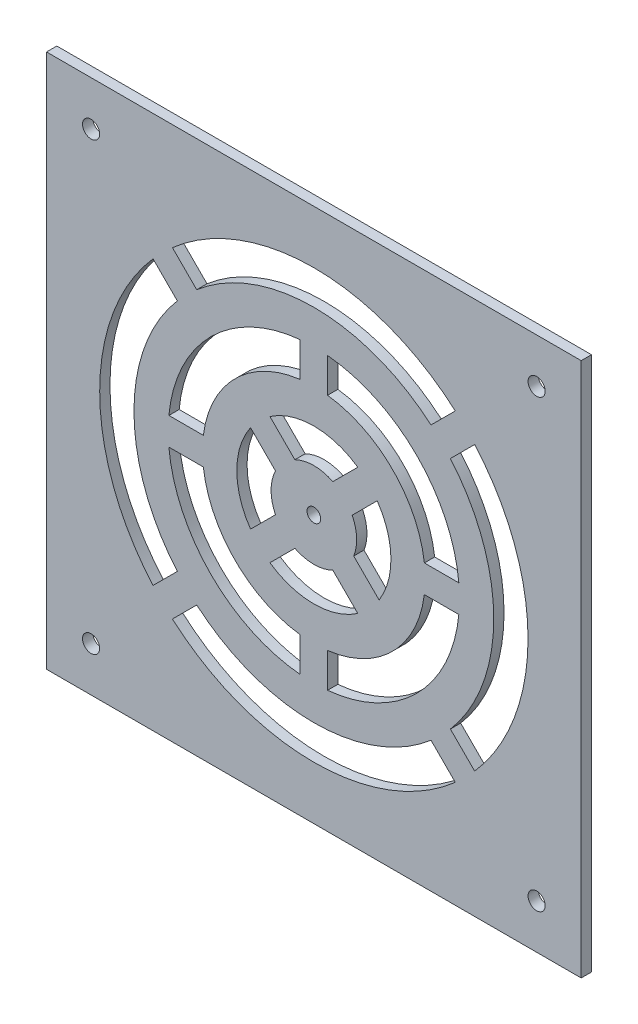
from build123d import *

# Parameters (mm, degrees)
SKETCH1_W           = 150
SKETCH1_H           = 150
BOSS_EXTRUDE1_DEPTH = 3
CUT_EXTRUDE1_DEPTH  = 264.0332057
SKETCH4_R           = 2.5
CUT_EXTRUDE2_DEPTH  = 3
SKETCH5_W           = 156
SKETCH5_H           = 156
SKETCH5_W_2         = 150
SKETCH5_H_2         = 150
BOSS_EXTRUDE2_DEPTH = 3
SKETCH6_R           = 2
CUT_EXTRUDE3_DEPTH  = 10


with BuildPart() as part:
    # Sketch1 → Boss-Extrude1 (new body)
    with BuildSketch(Plane.XY):
        with Locations((146.896551724, 66.206896552)):
            Rectangle(SKETCH1_W, SKETCH1_H)
    extrude(amount=BOSS_EXTRUDE1_DEPTH)

    # Sketch2 → Cut-Extrude1 (cut, through all)
    with BuildSketch(Plane.XY.offset(3)):
        with BuildLine():
            ThreePointArc((188.163122783, 113.13032186), (146.896551724, 128.694797217), (105.629980666, 113.13032186))
            Line((105.629980666, 113.13032186), (112.718359737, 106.041942789))
            ThreePointArc((112.718359737, 106.041942789), (146.896551724, 118.694797217), (181.074743712, 106.041942789))
            Line((181.074743712, 106.041942789), (188.163122783, 113.13032186))
        make_face()
        with BuildLine():
            Line((107.061505487, 100.385088539), (99.973126416, 107.47346761))
            ThreePointArc((99.973126416, 107.47346761), (84.408651059, 66.206896552), (99.973126416, 24.940325493))
            Line((99.973126416, 24.940325493), (107.061505487, 32.028704564))
            ThreePointArc((107.061505487, 32.028704564), (94.408651059, 66.206896552), (107.061505487, 100.385088539))
        make_face()
        with BuildLine():
            ThreePointArc((209.384452389, 66.206896552), (205.363995952, 88.259009716), (193.819977032, 107.47346761))
            Line((193.819977032, 107.47346761), (186.731597961, 100.385088539))
            ThreePointArc((186.731597961, 100.385088539), (196.119705149, 84.429434333), (199.384452389, 66.206896552))
            ThreePointArc((199.384452389, 66.206896552), (196.119705149, 47.984358771), (186.731597961, 32.028704564))
            Line((186.731597961, 32.028704564), (193.819977032, 24.940325493))
            ThreePointArc((193.819977032, 24.940325493), (205.363995952, 44.154783387), (209.384452389, 66.206896552))
        make_face()
        with BuildLine():
            Line((112.718359737, 26.371850315), (105.629980666, 19.283471244))
            ThreePointArc((105.629980666, 19.283471244), (146.896551724, 3.718995886), (188.163122783, 19.283471244))
            Line((188.163122783, 19.283471244), (181.074743712, 26.371850315))
            ThreePointArc((181.074743712, 26.371850315), (146.896551724, 13.718995886), (112.718359737, 26.371850315))
        make_face()
        with BuildLine():
            ThreePointArc((150.896551724, 23.907703853), (176.940034403, 36.163413873), (189.195744423, 62.206896552))
            Line((189.195744423, 62.206896552), (179.137266506, 62.206896552))
            ThreePointArc((179.137266506, 62.206896552), (169.868966591, 43.234481685), (150.896551724, 33.96618177))
            Line((150.896551724, 33.96618177), (150.896551724, 23.907703853))
        make_face()
        with BuildLine():
            Line((114.655836942, 62.206896552), (104.597359026, 62.206896552))
            ThreePointArc((104.597359026, 62.206896552), (116.853069045, 36.163413873), (142.896551724, 23.907703853))
            Line((142.896551724, 23.907703853), (142.896551724, 33.96618177))
            ThreePointArc((142.896551724, 33.96618177), (123.924136857, 43.234481685), (114.655836942, 62.206896552))
        make_face()
        with BuildLine():
            Line((142.896551724, 98.447611333), (142.896551724, 108.50608925))
            ThreePointArc((142.896551724, 108.50608925), (116.853069045, 96.250379231), (104.597359026, 70.206896552))
            Line((104.597359026, 70.206896552), (114.655836942, 70.206896552))
            ThreePointArc((114.655836942, 70.206896552), (123.924136857, 89.179311419), (142.896551724, 98.447611333))
        make_face()
        with BuildLine():
            ThreePointArc((189.195744423, 70.206896552), (176.940034403, 96.250379231), (150.896551724, 108.50608925))
            Line((150.896551724, 108.50608925), (150.896551724, 98.447611333))
            ThreePointArc((150.896551724, 98.447611333), (169.868966591, 89.179311419), (179.137266506, 70.206896552))
            Line((179.137266506, 70.206896552), (189.195744423, 70.206896552))
        make_face()
        with BuildLine():
            Line((165.372753073, 79.026243651), (158.090015102, 71.74350568))
            ThreePointArc((158.090015102, 71.74350568), (159.056537781, 69.049853135), (159.384452389, 66.206896552))
            ThreePointArc((159.384452389, 66.206896552), (159.166880972, 63.885973637), (158.521748029, 61.645923641))
            Line((158.521748029, 61.645923641), (165.932760465, 54.234911206))
            ThreePointArc((165.932760465, 54.234911206), (168.504305512, 59.977076926), (169.384452389, 66.206896552))
            ThreePointArc((169.384452389, 66.206896552), (168.358106385, 72.923096956), (165.372753073, 79.026243651))
        make_face()
        with BuildLine():
            Line((134.077204625, 84.6830979), (141.359942596, 77.400359929))
            ThreePointArc((141.359942596, 77.400359929), (146.896551724, 78.694797217), (152.433160852, 77.400359929))
            Line((152.433160852, 77.400359929), (159.715898823, 84.6830979))
            ThreePointArc((159.715898823, 84.6830979), (146.896551724, 88.694797217), (134.077204625, 84.6830979))
        make_face()
        with BuildLine():
            ThreePointArc((135.703088346, 60.670287424), (134.408651059, 66.206896552), (135.703088346, 71.74350568))
            Line((135.703088346, 71.74350568), (128.420350375, 79.026243651))
            ThreePointArc((128.420350375, 79.026243651), (124.408651059, 66.206896552), (128.420350375, 53.387549452))
            Line((128.420350375, 53.387549452), (135.703088346, 60.670287424))
        make_face()
        with BuildLine():
            ThreePointArc((152.433160852, 55.013433174), (146.896551724, 53.718995886), (141.359942596, 55.013433174))
            Line((141.359942596, 55.013433174), (134.077204625, 47.730695203))
            ThreePointArc((134.077204625, 47.730695203), (146.896551724, 43.718995886), (159.715898823, 47.730695203))
            Line((159.715898823, 47.730695203), (152.433160852, 55.013433174))
        make_face()
    extrude(amount=-CUT_EXTRUDE1_DEPTH, mode=Mode.SUBTRACT)

    # Sketch4 → Cut-Extrude2 (cut)
    with BuildSketch(Plane.XY.offset(3)):
        with Locations((81.896551724, 131.206896552)):
            Circle(SKETCH4_R)
        with Locations((211.896551724, 131.206896552)):
            Circle(SKETCH4_R)
        with Locations((211.896551724, 1.206896552)):
            Circle(SKETCH4_R)
        with Locations((81.896551724, 1.206896552)):
            Circle(SKETCH4_R)
    extrude(amount=-CUT_EXTRUDE2_DEPTH, mode=Mode.SUBTRACT)

    # Sketch5 → Boss-Extrude2 (add)
    with BuildSketch(Plane(origin=(0, 0, 0), x_dir=(-1, 0, 0), z_dir=(0, 0, -1))):
        with Locations((-146.896551724, 66.206896552)):
            Rectangle(SKETCH5_W, SKETCH5_H)
        with Locations((-146.896551724, 66.206896552)):
            Rectangle(SKETCH5_W_2, SKETCH5_H_2, mode=Mode.SUBTRACT)
    extrude(amount=-BOSS_EXTRUDE2_DEPTH)

    # Sketch6 → Cut-Extrude3 (cut)
    with BuildSketch(Plane.XY.offset(3)):
        with Locations((146.896551724, 66.206896552)):
            Circle(SKETCH6_R)
    extrude(amount=-CUT_EXTRUDE3_DEPTH, mode=Mode.SUBTRACT)


solid = part.part
